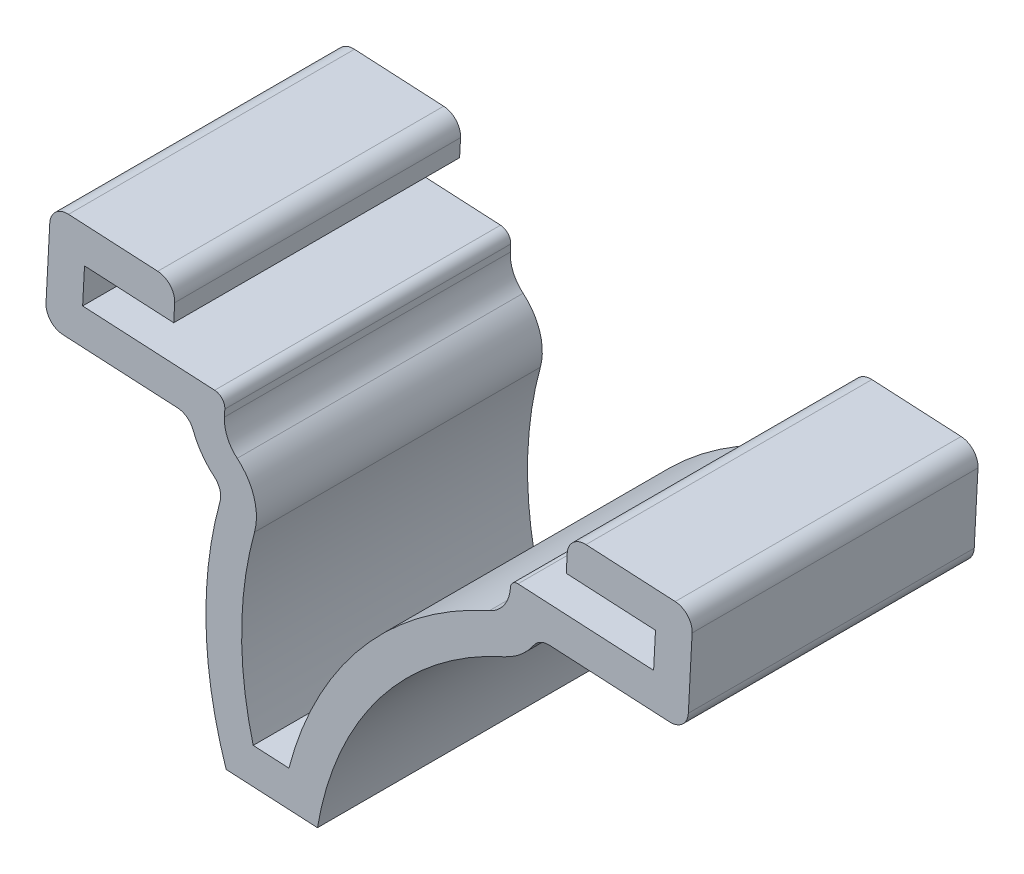
from build123d import *

# Parameters (mm, degrees)
EXTRUSION1_DEPTH = 8


with BuildPart() as part:
    # Esquisse1 → Extrusion1 (new body)
    with BuildSketch(Plane.XY):
        with BuildLine():
            Line((-30.067257497, 113.177740746), (-26.372396833, 112.98279286))
            ThreePointArc((-26.372396833, 112.98279286), (-26.165189094, 112.883870001), (-26.088620122, 112.667402978))
            Line((-26.088620122, 112.667402978), (-26.099157845, 112.46768078))
            ThreePointArc((-26.099157845, 112.46768078), (-26.017294744, 112.015525883), (-25.741864343, 111.647716541))
            ThreePointArc((-25.741864343, 111.647716541), (-25.272050301, 110.943990552), (-25.257835426, 110.097968424))
            ThreePointArc((-25.257835426, 110.097968424), (-25.617558346, 107.508747112), (-25.293951096, 104.914764474))
            Line((-25.293951096, 104.914764474), (-24.295340106, 104.862075856))
            ThreePointArc((-24.295340106, 104.862075856), (-22.246338792, 108.812632079), (-18.686198774, 111.482969868))
            ThreePointArc((-18.686198774, 111.482969868), (-18.269079288, 111.829964974), (-18.094570878, 112.343716941))
            Line((-18.094570878, 112.343716941), (-18.094463339, 112.345755135))
            ThreePointArc((-18.094463339, 112.345755135), (-18.028514766, 112.483893628), (-17.884203417, 112.534939609))
            Line((-17.884203417, 112.534939609), (-14.089481655, 112.334722862))
            Line((-14.089481655, 112.334722862), (-14.036793037, 113.333333852))
            Line((-14.036793037, 113.333333852), (-16.533320513, 113.465055396))
            Line((-16.533320513, 113.465055396), (-16.506976204, 113.964360891))
            ThreePointArc((-16.506976204, 113.964360891), (-16.342104771, 114.309707124), (-15.9813264, 114.437322078))
            Line((-15.9813264, 114.437322078), (-13.484798924, 114.305600533))
            ThreePointArc((-13.484798924, 114.305600533), (-13.139452692, 114.1407291), (-13.011837738, 113.779950729))
            Line((-13.011837738, 113.779950729), (-13.117214974, 111.782728749))
            ThreePointArc((-13.117214974, 111.782728749), (-13.282086407, 111.437382517), (-13.642864778, 111.309767563))
            Line((-13.642864778, 111.309767563), (-17.001536207, 111.486977464))
            ThreePointArc((-17.001536207, 111.486977464), (-17.249736921, 111.435756488), (-17.440940787, 111.269418687))
            ThreePointArc((-17.440940787, 111.269418687), (-17.811384631, 110.86115449), (-18.27921568, 110.569534177))
            ThreePointArc((-18.27921568, 110.569534177), (-21.738141003, 107.85137108), (-23.495527443, 103.818485275))
            Line((-23.495527443, 103.818485275), (-26.050896674, 103.953311422))
            ThreePointArc((-26.050896674, 103.953311422), (-26.613892326, 107.145851257), (-26.221838859, 110.363858214))
            ThreePointArc((-26.221838859, 110.363858214), (-26.226577151, 110.64586559), (-26.383181832, 110.880440919))
            ThreePointArc((-26.383181832, 110.880440919), (-26.732137821, 111.258311168), (-26.97318193, 111.712683202))
            ThreePointArc((-26.97318193, 111.712683202), (-27.145818586, 111.940425538), (-27.41499639, 112.036411457))
            Line((-27.41499639, 112.036411457), (-30.61925161, 112.205474065))
            ThreePointArc((-30.61925161, 112.205474065), (-30.964597842, 112.370345498), (-31.092212796, 112.731123869))
            Line((-31.092212796, 112.731123869), (-30.98683556, 114.728345849))
            ThreePointArc((-30.98683556, 114.728345849), (-30.821964127, 115.073692081), (-30.461185756, 115.201307035))
            Line((-30.461185756, 115.201307035), (-27.964658281, 115.069585491))
            ThreePointArc((-27.964658281, 115.069585491), (-27.619312049, 114.904714058), (-27.491697095, 114.543935687))
            Line((-27.491697095, 114.543935687), (-27.518041404, 114.044630192))
            Line((-27.518041404, 114.044630192), (-30.014568879, 114.176351736))
            Line((-30.014568879, 114.176351736), (-30.067257497, 113.177740746))
        make_face()
    extrude(amount=EXTRUSION1_DEPTH)


solid = part.part
